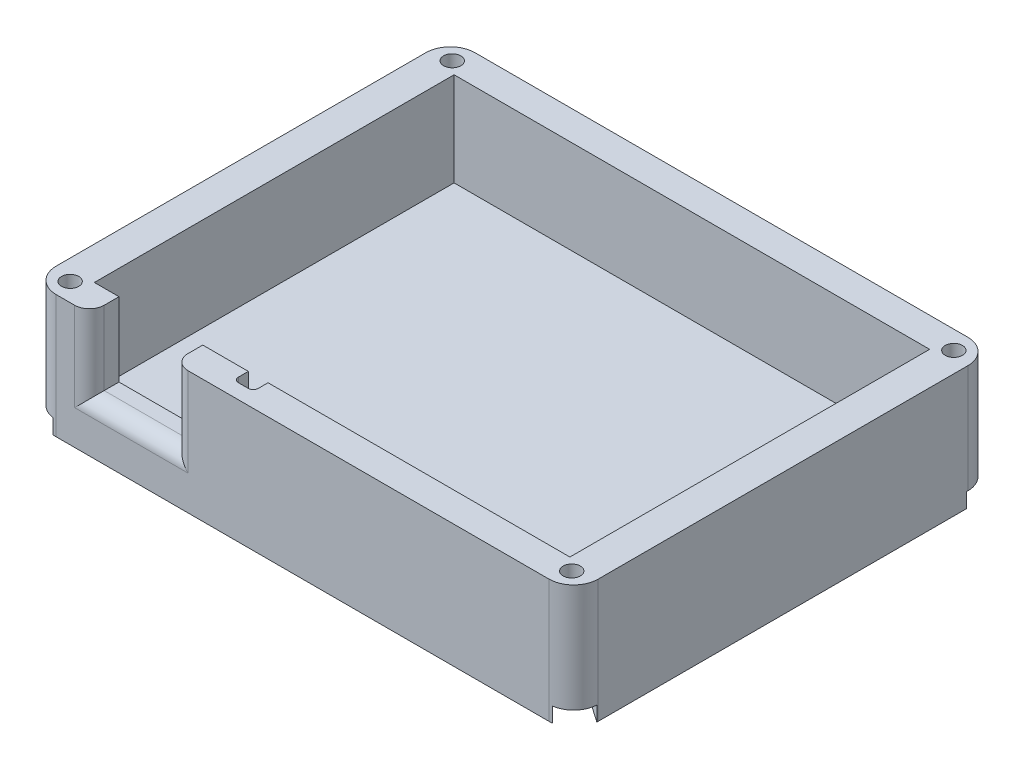
from build123d import *

# Parameters (mm, degrees)
SKETCH1_W                 = 110
SKETCH1_H                 = 85
BASE_DEPTH                = 25
FILLET1_R                 = 5
SKETCH2_W                 = 96.5
SKETCH2_H                 = 73
BASKET_DEPTH              = 19
SKETCH3_W                 = 4
SKETCH3_H                 = 6
WIRE_CHANNEL_DEPTH        = 19
WIRE_CHANNEL_ROUNDING_R   = 1
SWITCH_CUT_OUT_REACH      = 106.283
SKETCH5_W                 = 17
SKETCH5_H                 = 15
SWITCH_CUT_OUT_ROUNDING_R = 3
SKETCH14_R                = 1.75
CORNER_HOLES_DEPTH        = 74.866433513
BOTTOM_NUT_CUT_OUT_DEPTH  = 3


with BuildPart() as part:
    # Sketch1 → Base (new body)
    with BuildSketch(Plane(origin=(0, 0, 0), x_dir=(1, 0, 0), z_dir=(0, 1, 0))):
        Rectangle(SKETCH1_W, SKETCH1_H)
    extrude(amount=BASE_DEPTH)

    # Fillet1
    fillet1_edges = [part.edges().sort_by_distance(p)[0] for p in [
        (55, 12.5, 42.5),
        (-55, 12.5, 42.5),
        (-55, 12.5, -42.5),
        (55, 12.5, -42.5),
    ]]
    fillet(fillet1_edges, radius=FILLET1_R)

    # Sketch2 → Basket (cut)
    with BuildSketch(Plane(origin=(0, 25, 0), x_dir=(1, 0, 0), z_dir=(0, 1, 0))):
        Rectangle(SKETCH2_W, SKETCH2_H)
    extrude(amount=-BASKET_DEPTH, mode=Mode.SUBTRACT)

    # Sketch3 → Wire Channel (cut)
    with BuildSketch(Plane(origin=(0, 25, 0), x_dir=(1, 0, 0), z_dir=(0, 1, 0))):
        with Locations((-15, -36.5)):
            Rectangle(SKETCH3_W, SKETCH3_H)
    extrude(amount=-WIRE_CHANNEL_DEPTH, mode=Mode.SUBTRACT)

    # Wire Channel Rounding
    wire_channel_rounding_edges = [part.edges().sort_by_distance(p)[0] for p in [
        (-17, 15.5, 39.5),
        (-13, 15.5, 39.5),
    ]]
    fillet(wire_channel_rounding_edges, radius=WIRE_CHANNEL_ROUNDING_R)

    # Sketch5 → Switch Cut-out (cut, up to next)
    with BuildSketch(Plane.XY.offset(42.5), mode=Mode.PRIVATE) as switch_cut_out_sk1:
        with Locations((-34.75, 17.5)):
            Rectangle(SKETCH5_W, SKETCH5_H)
    switch_cut_out_tool1 = extrude(switch_cut_out_sk1.sketch, amount=-SWITCH_CUT_OUT_REACH, mode=Mode.PRIVATE) & part.part
    add(switch_cut_out_tool1.solids().sort_by_distance((-34.75, 17.5, 42.5))[0], mode=Mode.SUBTRACT)

    # Switch Cut-out Rounding
    switch_cut_out_rounding_edges = [part.edges().sort_by_distance(p)[0] for p in [
        (-43.25, 17.5, 42.5),
        (-34.75, 10, 42.5),
        (-26.25, 17.5, 42.5),
    ]]
    fillet(switch_cut_out_rounding_edges, radius=SWITCH_CUT_OUT_ROUNDING_R)

    # Sketch14 → Corner Holes (cut, through all)
    with BuildSketch(Plane(origin=(0, 25, 0), x_dir=(1, 0, 0), z_dir=(0, 1, 0))):
        with Locations(Location((-50.892766953, 38.767766953, 0), (0, 0, 270))):
            Circle(SKETCH14_R)
        with Locations(Location((50.892766953, 38.767766953, 0), (0, 0, 270))):
            Circle(SKETCH14_R)
        with Locations(Location((50.892766953, -38.767766953, 0), (0, 0, 270))):
            Circle(SKETCH14_R)
        with Locations(Location((-50.892766953, -38.767766953, 0), (0, 0, 270))):
            Circle(SKETCH14_R)
    extrude(amount=-CORNER_HOLES_DEPTH, mode=Mode.SUBTRACT)

    # Sketch15 → Bottom Nut Cut-out (cut)
    with BuildSketch(Plane.XZ):
        Polygon((-50.64101323, 42.388469214), (-52.178282629, 43.416097239), (-55.727023172, 38.10739593), (-54.143831126, 37.15203238), (-51.13140477, 35.13829702), (-47.868872697, 36.746365575), (-47.630234881, 40.375835508), align=None)
        Polygon((50.595962101, 42.39294376), (52.091508492, 43.427758232), (55.676210978, 38.247033564), (54.180664587, 37.212219092), (51.189571805, 35.142590146), (47.901674171, 36.698138008), (47.604869319, 40.323314814), align=None)
        Polygon((54.167766953, -36.699113605), (55.742766953, -37.608440279), (52.313760602, -43.547653498), (50.738760602, -42.638326824), (47.463760602, -40.747504693), (47.463760602, -36.788029213), (50.892766953, -34.808291473), align=None)
        Polygon((-53.9527362, -36.801402743), (-55.569189191, -37.634817242), (-52.682156679, -43.23437466), (-51.065703688, -42.400960161), (-47.832797706, -40.734131163), (-47.65986097, -37.100937955), (-50.719830218, -35.134573745), align=None)
    extrude(amount=-BOTTOM_NUT_CUT_OUT_DEPTH, mode=Mode.SUBTRACT)


solid = part.part
